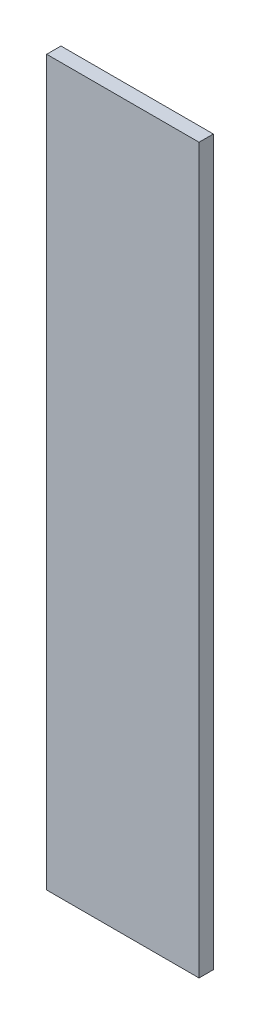
from build123d import *

# Parameters (mm, degrees)
SZKIC1_W                    = 320
SZKIC1_H                    = 1520
DODANIE_WYCI_GNI_CIE1_DEPTH = 30


with BuildPart() as part:
    # Szkic1 → Dodanie-wyciągnięcie1 (new body)
    with BuildSketch(Plane.XY):
        with Locations((160, 760)):
            Rectangle(SZKIC1_W, SZKIC1_H)
    extrude(amount=DODANIE_WYCI_GNI_CIE1_DEPTH)


solid = part.part
